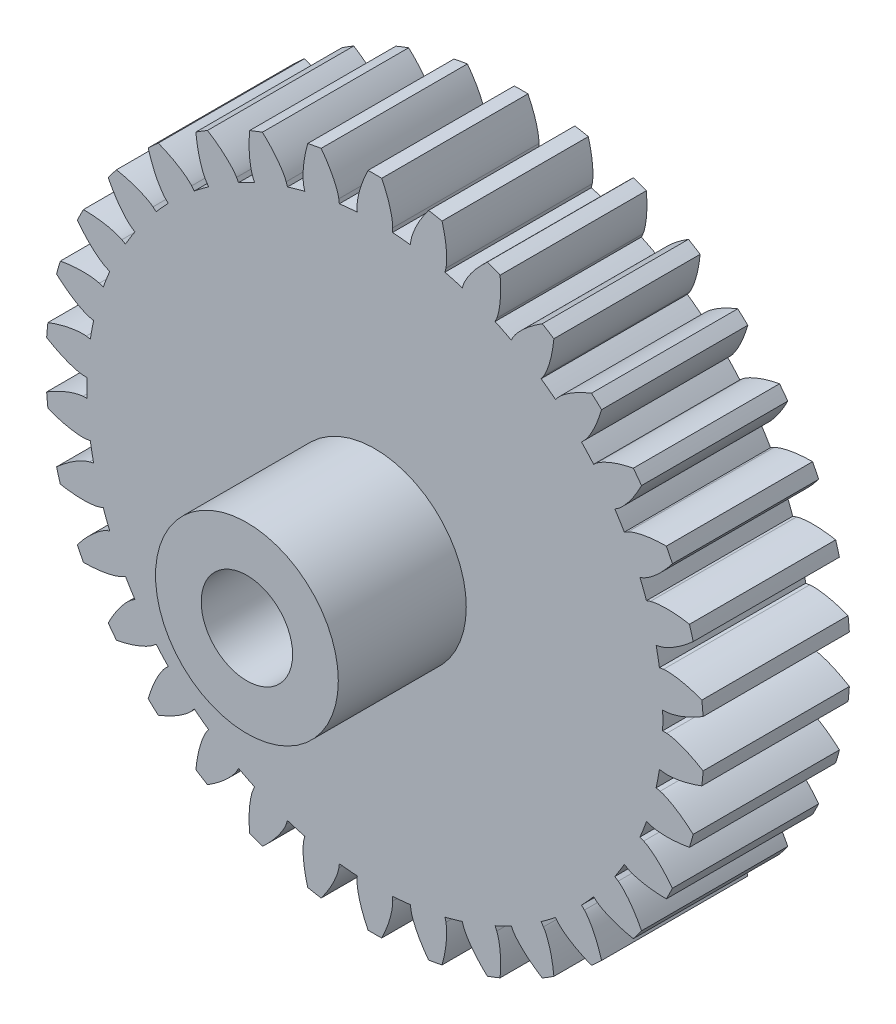
from build123d import *

# Parameters (mm, degrees)
SZKIC1_R                    = 18
DODANIE_WYCI_GNI_CIE1_DEPTH = 8
SZKIC2_R                    = 5
DODANIE_WYCI_GNI_CIE2_DEPTH = 7
SZKIC3_R                    = 2.5
WYTNIJ_WYCI_GNI_CIE1_DEPTH  = 30.546573405
WYTNIJ_WYCI_GNI_CIE3_DEPTH  = 30.546573405
SZYK_KO_OWY2_COUNT          = 34
SZKIC6_R                    = 13.1
WYTNIJ_WYCI_GNI_CIE5_DEPTH  = 5.6


with BuildPart() as part:
    # Szkic1 → Dodanie-wyciągnięcie1 (new body)
    with BuildSketch(Plane.XY):
        Circle(SZKIC1_R)
    extrude(amount=DODANIE_WYCI_GNI_CIE1_DEPTH)

    # Szkic2 → Dodanie-wyciągnięcie2 (add)
    with BuildSketch(Plane.XY.offset(8)):
        Circle(SZKIC2_R)
    extrude(amount=DODANIE_WYCI_GNI_CIE2_DEPTH)

    # Szkic3 → Wytnij-wyciągnięcie1 (cut, through all)
    with BuildSketch(Plane.XY.offset(15)):
        Circle(SZKIC3_R)
    extrude(amount=-WYTNIJ_WYCI_GNI_CIE1_DEPTH, mode=Mode.SUBTRACT)

    # Szkic4 → Wytnij-wyciągnięcie3 (cut, through all)
    with BuildSketch(Plane(origin=(0, 0, 0), x_dir=(-1, 0, 0), z_dir=(0, 0, -1))):
        with BuildLine():
            add(Edge.make_bspline(
                [(15.966952274, 0.499857083), (15.973588962, 0.500170319), (15.992186505, 0.50137492), (16.02727088, 0.504939353), (16.084356841, 0.51257942), (16.156811425, 0.524989314), (16.250055561, 0.544090693), (16.35930311, 0.570516104), (16.478642956, 0.603649308), (16.607603741, 0.644089594), (16.735410352, 0.688300579), (16.862041069, 0.735980193), (16.98736125, 0.78669031), (17.138115077, 0.851887366), (17.31737635, 0.935292978), (17.524511841, 1.040318379), (17.71815035, 1.147138444), (17.855509236, 1.228083556), (17.933604649, 1.275621993), (17.953855397, 1.288051396)],
                knots=[0, 0, 0, 0, 0, 0.005376749, 0.015083688, 0.02853182, 0.046610139, 0.064854849, 0.092110525, 0.119476176, 0.146842496, 0.174208854, 0.201574956, 0.228941013, 0.256307345, 0.307035032, 0.361767352, 0.416499661, 0.435734814, 0.435734814, 0.435734814, 0.435734814, 0.435734814], degree=4))
            Line((15.966952274, 0.499857083), (15.742287785, 0.492823797))
            ThreePointArc((15.742287785, 0.492823797), (15.75, 0), (15.742287785, -0.492823797))
            Line((15.742287785, -0.492823797), (15.966952274, -0.499857083))
            add(Edge.make_bspline(
                [(15.966952274, -0.499857083), (15.973588962, -0.500170319), (15.992186505, -0.50137492), (16.02727088, -0.504939353), (16.084356841, -0.51257942), (16.156811425, -0.524989314), (16.250055561, -0.544090693), (16.35930311, -0.570516104), (16.478642956, -0.603649308), (16.607603741, -0.644089594), (16.735410352, -0.688300579), (16.862041069, -0.735980193), (16.98736125, -0.78669031), (17.138115077, -0.851887366), (17.31737635, -0.935292978), (17.524511841, -1.040318379), (17.71815035, -1.147138444), (17.855509236, -1.228083556), (17.933604649, -1.275621993), (17.953855397, -1.288051396)],
                knots=[0, 0, 0, 0, 0, 0.005376749, 0.015083688, 0.02853182, 0.046610139, 0.064854849, 0.092110525, 0.119476176, 0.146842496, 0.174208854, 0.201574956, 0.228941013, 0.256307345, 0.307035032, 0.361767352, 0.416499661, 0.435734814, 0.435734814, 0.435734814, 0.435734814, 0.435734814], degree=4))
            ThreePointArc((17.953855397, -1.288051396), (17.98846015, -0.644438849), (18, 0))
            ThreePointArc((18, 0), (17.98846015, 0.644438849), (17.953855397, 1.288051396))
        make_face()
        with BuildLine():
            ThreePointArc((17.411478068, -4.565132145), (17.693515794, -3.307491321), (17.884835713, -2.032892399))
            add(Edge.make_bspline(
                [(15.786933067, -2.442573715), (15.79351431, -2.443485301), (15.812016539, -2.4457185), (15.847158499, -2.448661495), (15.904676322, -2.451641033), (15.978177541, -2.452755935), (16.073343888, -2.451113359), (16.185586946, -2.445212075), (16.308983015, -2.434571666), (16.44317888, -2.418516435), (16.576933087, -2.398542629), (16.710168782, -2.374943184), (16.842673108, -2.348124026), (17.002839993, -2.311738017), (17.194374743, -2.262691716), (17.417281726, -2.197515619), (17.627251306, -2.128095352), (17.777145022, -2.073768113), (17.862645876, -2.041389102), (17.884835713, -2.032892399)],
                knots=[0, 0, 0, 0, 0, 0.005376749, 0.015083688, 0.02853182, 0.046610139, 0.064854849, 0.092110525, 0.119476176, 0.146842496, 0.174208854, 0.201574956, 0.228941013, 0.256307345, 0.307035032, 0.361767352, 0.416499661, 0.435734814, 0.435734814, 0.435734814, 0.435734814, 0.435734814], degree=4))
            Line((15.786933067, -2.442573715), (15.564801555, -2.408205254))
            ThreePointArc((15.564801555, -2.408205254), (15.48182632, -2.894054906), (15.383689285, -3.377070325))
            Line((15.383689285, -3.377070325), (15.603236072, -3.425265848))
            add(Edge.make_bspline(
                [(15.603236072, -3.425265848), (15.6097022, -3.426793239), (15.62776174, -3.431394618), (15.661593774, -3.441345097), (15.716303879, -3.459344595), (15.785244474, -3.484856683), (15.873391083, -3.520766389), (15.975922828, -3.566816041), (16.087142476, -3.621313729), (16.206476576, -3.684761925), (16.323983288, -3.751704536), (16.439696771, -3.821840647), (16.553565178, -3.894714851), (16.689772207, -3.986502747), (16.850655475, -4.101427392), (17.034965725, -4.242725582), (17.205679034, -4.383307815), (17.325825499, -4.488114312), (17.393856024, -4.549193312), (17.411478068, -4.565132145)],
                knots=[0, 0, 0, 0, 0, 0.005376749, 0.015083688, 0.02853182, 0.046610139, 0.064854849, 0.092110525, 0.119476176, 0.146842496, 0.174208854, 0.201574956, 0.228941013, 0.256307345, 0.307035032, 0.361767352, 0.416499661, 0.435734814, 0.435734814, 0.435734814, 0.435734814, 0.435734814], degree=4))
        make_face()
    wytnij_wyci_gni_cie3 = extrude(amount=-WYTNIJ_WYCI_GNI_CIE3_DEPTH, mode=Mode.SUBTRACT)

    # Szyk kołowy2: Wytnij-wyciągnięcie3 ×34 about axis
    szyk_ko_owy2_axis = Axis((0, 0, 0), (0, 0, 1))
    for i in range(1, SZYK_KO_OWY2_COUNT):
        add(wytnij_wyci_gni_cie3.rotate(szyk_ko_owy2_axis, i * 360 / SZYK_KO_OWY2_COUNT), mode=Mode.SUBTRACT)

    # Szkic6 → Wytnij-wyciągnięcie5 (cut)
    with BuildSketch(Plane(origin=(0, 0, 0), x_dir=(-1, 0, 0), z_dir=(0, 0, -1))):
        Circle(SZKIC6_R)
    extrude(amount=-WYTNIJ_WYCI_GNI_CIE5_DEPTH, mode=Mode.SUBTRACT)


solid = part.part
